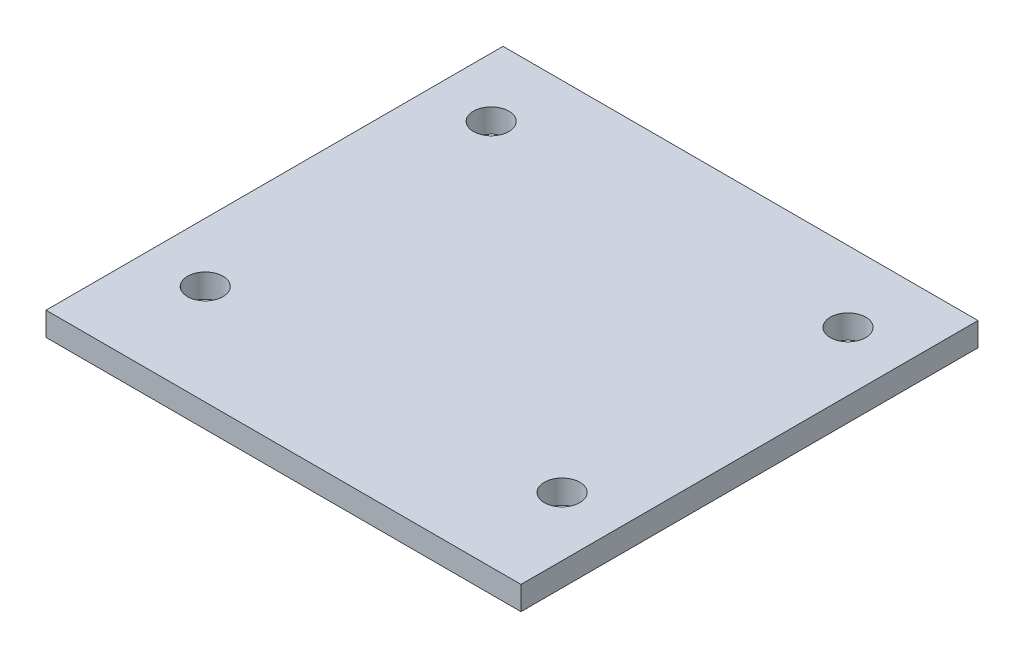
from build123d import *

# Parameters (mm, degrees)
SKETCH1_W           = 40.2
SKETCH1_H           = 38.678855934
SKETCH1_R           = 1.5
BOSS_EXTRUDE1_DEPTH = 2


with BuildPart() as part:
    # Sketch1 → Boss-Extrude1 (new body)
    with BuildSketch(Plane(origin=(0, 0, 0), x_dir=(1, 0, 0), z_dir=(0, 1, 0))):
        Rectangle(SKETCH1_W, SKETCH1_H)
        with Locations(Location((-15.1, 13.339427967, 0), (0, 0, 270))):
            Circle(SKETCH1_R, mode=Mode.SUBTRACT)
        with Locations(Location((15.1, 13.339427967, 0), (0, 0, 270))):
            Circle(SKETCH1_R, mode=Mode.SUBTRACT)
        with Locations(Location((15.1, -10.860572033, 0), (0, 0, 270))):
            Circle(SKETCH1_R, mode=Mode.SUBTRACT)
        with Locations(Location((-15.1, -10.860572033, 0), (0, 0, 270))):
            Circle(SKETCH1_R, mode=Mode.SUBTRACT)
    extrude(amount=BOSS_EXTRUDE1_DEPTH)


solid = part.part
